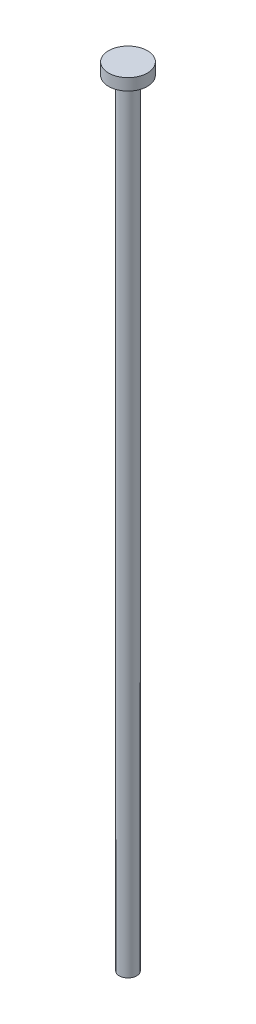
from build123d import *

# Parameters (mm, degrees)
SKETCH1_R           = 2.25
BOSS_EXTRUDE1_DEPTH = 100
SKETCH2_R           = 5
BOSS_EXTRUDE2_DEPTH = 3


with BuildPart() as part:
    # Sketch1 → Boss-Extrude1 (new, symmetric)
    with BuildSketch(Plane(origin=(0, 0, 0), x_dir=(1, 0, 0), z_dir=(0, 1, 0))):
        with Locations(Location((0, 0, 0), (0, 0, 270))):
            Circle(SKETCH1_R)
    extrude(amount=BOSS_EXTRUDE1_DEPTH, both=True)

    # Sketch2 → Boss-Extrude2 (add)
    with BuildSketch(Plane(origin=(0, 100, 0), x_dir=(1, 0, 0), z_dir=(0, 1, 0))):
        with Locations(Location((0, 0, 0), (0, 0, 270))):
            Circle(SKETCH2_R)
    extrude(amount=BOSS_EXTRUDE2_DEPTH)


solid = part.part
